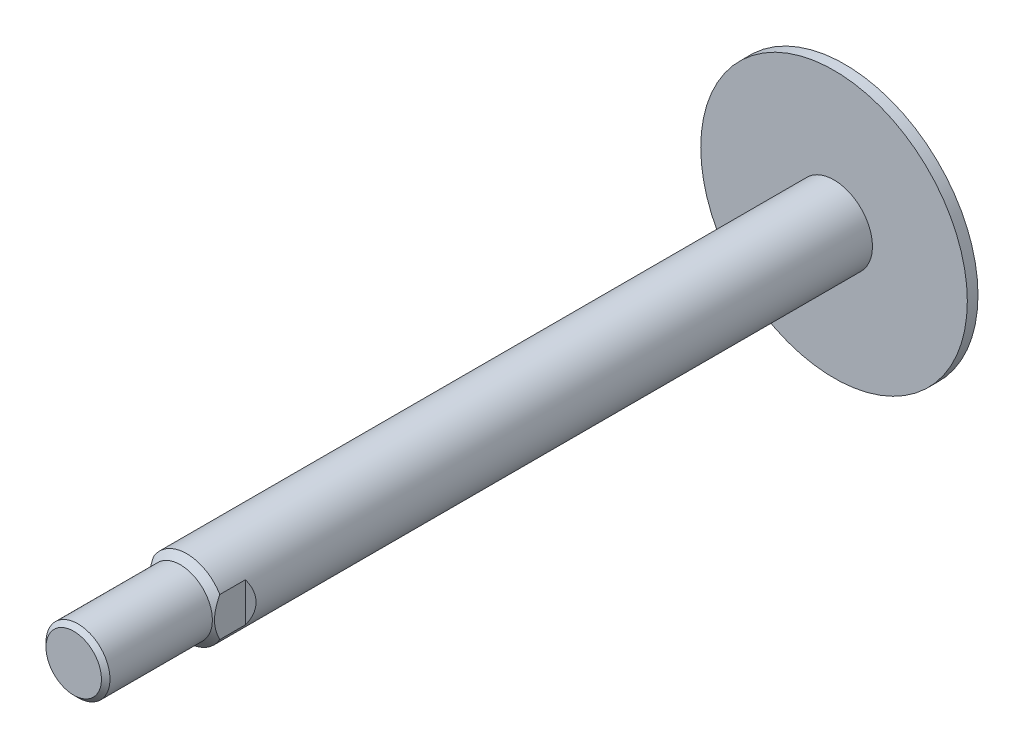
from build123d import *

# Parameters (mm, degrees)
SKETCH1_R          = 18
BASE_EXTRUDE_DEPTH = 361.5
SKETCH2_R          = 62.5
PISTON_DEPTH       = 5
FLATS_DEPTH        = 373.148827756
FLATS_DEPTH_BACK   = 373.148827756


with BuildPart() as part:
    # Sketch1 → Base-Extrude (new body)
    with BuildSketch(Plane.XY):
        Circle(SKETCH1_R)
    extrude(amount=BASE_EXTRUDE_DEPTH)

    # Sketch2 → Piston (add)
    with BuildSketch(Plane(origin=(0, 0, 0), x_dir=(-1, 0, 0), z_dir=(0, 0, -1))):
        Circle(SKETCH2_R)
    extrude(amount=-PISTON_DEPTH)

    # Sketch3 → Thread (revolve, cut)
    with BuildSketch(Plane(origin=(0, 0, 0), x_dir=(0, 0, -1), z_dir=(1, 0, 0)), mode=Mode.PRIVATE) as thread_sk:
        Polygon((-361.5, 18), (-361.5, 13), (-359.5, 15), (-311.5, 15), (-308.5, 18), align=None)
    revolve(thread_sk.sketch.rotate(Axis((0, 0, 0), (0, 0, 1)), 90), axis=Axis((0, 0, 0), (0, 0, 1)), mode=Mode.SUBTRACT)

    # Sketch4 → Flats (cut, two sides: drawn at the far end of the back side and taken through both)
    with BuildSketch(Plane(origin=(0, 0, 0), x_dir=(1, 0, 0), z_dir=(0, 1, 0)).offset(-FLATS_DEPTH_BACK)):
        Polygon((18, -294), (15.5, -296.5), (15.5, -361.5), (18, -361.5), align=None)
        Polygon((-18, -361.5), (-18, -294), (-15.5, -296.5), (-15.5, -361.5), align=None)
    extrude(amount=FLATS_DEPTH + FLATS_DEPTH_BACK, mode=Mode.SUBTRACT)


solid = part.part
